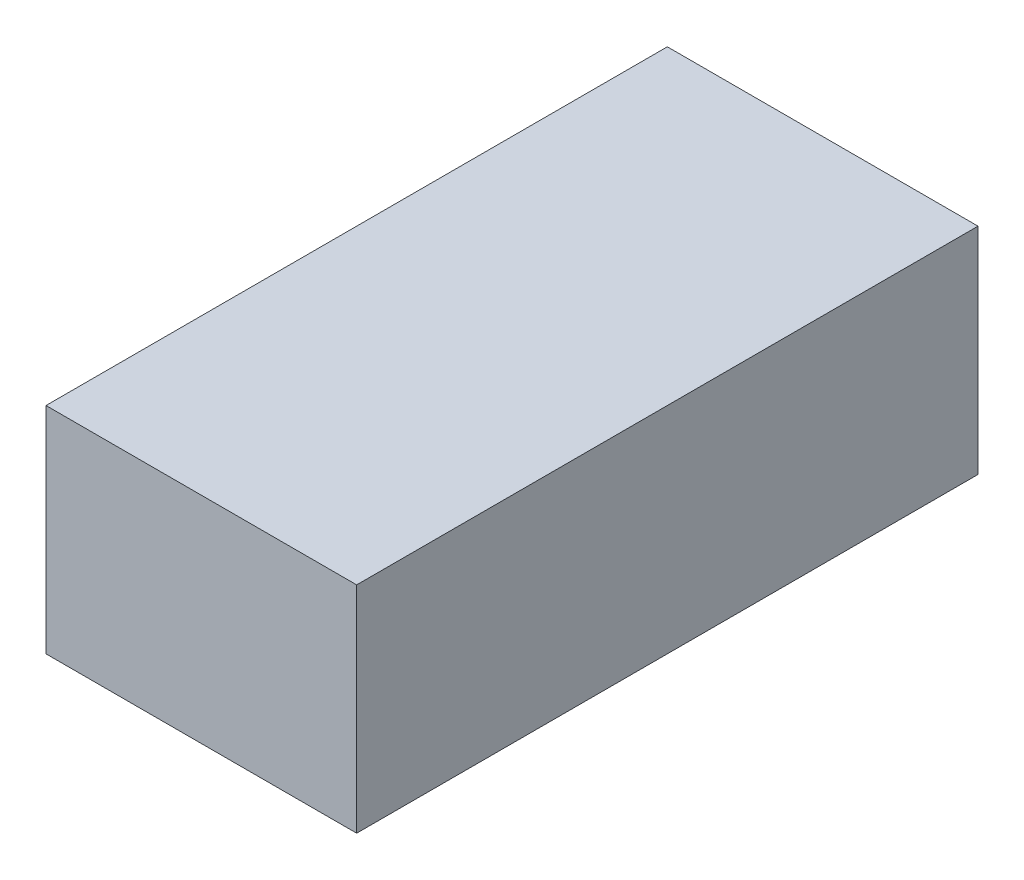
from build123d import *

# Parameters (mm, degrees)
SKETCH_1_W      = 13
SKETCH_1_H      = 26
EXTRUDE_1_DEPTH = 9


with BuildPart() as part:
    # 草图1 → 凸台-拉伸1 (new body)
    with BuildSketch(Plane(origin=(0, 0, 0), x_dir=(1, 0, 0), z_dir=(0, 1, 0))):
        Rectangle(SKETCH_1_W, SKETCH_1_H)
    extrude(amount=EXTRUDE_1_DEPTH)


solid = part.part
